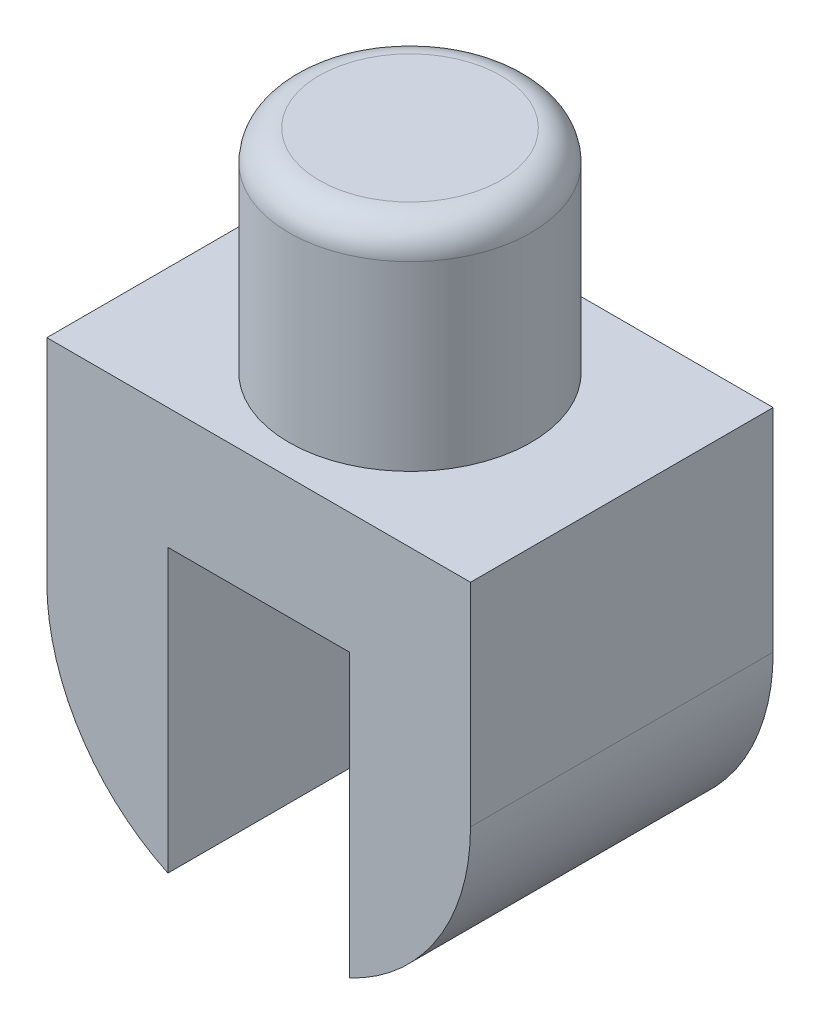
from build123d import *

# Parameters (mm, degrees)
HAND_DEPTH            = 2.5
HAND_DEPTH_BACK       = 2.5
SKETCH3_R             = 2
WRIST_DEPTH           = 7
FINGER_GAP_DEPTH      = 1.5
FINGER_GAP_DEPTH_BACK = 9.215838363
SKETCH2_W             = 3
SKETCH2_H             = 6
EASY_INSERT_R         = 0.5
SCALE1_SCALE          = 2


with BuildPart() as part:
    # Sketch1 → Hand (new, two sides: drawn at the far end of the back side and taken through both)
    with BuildSketch(Plane.XY.offset(-HAND_DEPTH_BACK)):
        with BuildLine():
            Line((-3.5, 0), (-3.5, 3.5))
            Line((-3.5, 3.5), (3.5, 3.5))
            Line((3.5, 3.5), (3.5, 0))
            ThreePointArc((3.5, 0), (0, -3.5), (-3.5, 0))
        make_face()
    extrude(amount=HAND_DEPTH + HAND_DEPTH_BACK)

    # Sketch3 → Wrist (add)
    with BuildSketch(Plane(origin=(0, 0, 0), x_dir=(1, 0, 0), z_dir=(0, 1, 0))):
        Circle(SKETCH3_R)
    extrude(amount=WRIST_DEPTH)

    # Sketch2 → Finger gap (cut, two sides: drawn at the far end of the back side and taken through both)
    with BuildSketch(Plane(origin=(0, 0, 0), x_dir=(1, 0, 0), z_dir=(0, 1, 0)).offset(-FINGER_GAP_DEPTH_BACK)):
        Rectangle(SKETCH2_W, SKETCH2_H)
    extrude(amount=FINGER_GAP_DEPTH + FINGER_GAP_DEPTH_BACK, mode=Mode.SUBTRACT)

    # Easy insert
    easy_insert_edges = [part.edges().sort_by_distance(p)[0] for p in [
        (-2, 7, 0),
    ]]
    fillet(easy_insert_edges, radius=EASY_INSERT_R)


with BuildPart() as part_1:
    # Scale1: scaled about (0, 1.946660074, 0)
    add(part.part.scale(SCALE1_SCALE).moved(Location((0, -1.946660074, 0))))


solid = part_1.part
